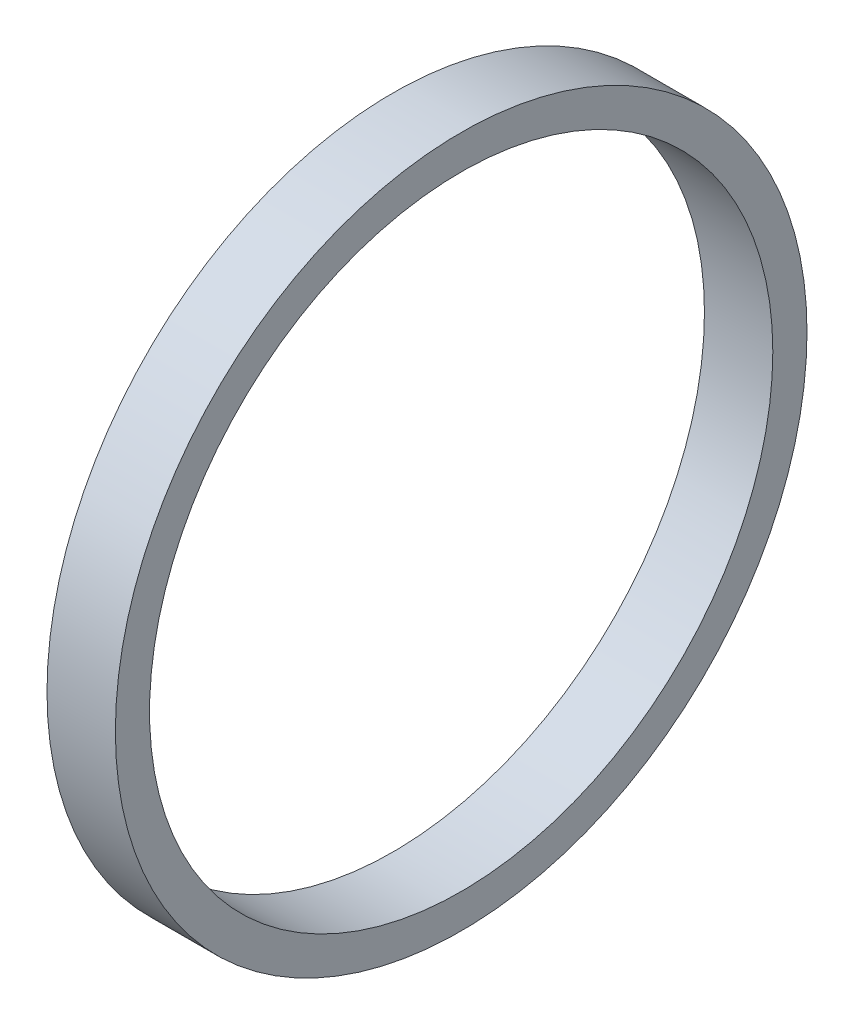
from build123d import *

# Parameters (mm, degrees)
SKETCH2_R           = 30.35
SKETCH2_R_2         = 27.35
BOSS_EXTRUDE1_DEPTH = 6


with BuildPart() as part:
    # Sketch2 → Boss-Extrude1 (new body)
    with BuildSketch(Plane(origin=(-607.283297965, -0.378059601, -0.400909904), x_dir=(0, 0.7275361131199374, -0.686069387238881), z_dir=(1, 0, 0))):
        with Locations(Location((0, 0.551051552, 0), (0, 0, 313.319766534))):
            Circle(SKETCH2_R)
        with Locations(Location((0, 0.551051552, 0), (0, 0, 313.319766534))):
            Circle(SKETCH2_R_2, mode=Mode.SUBTRACT)
    extrude(amount=-BOSS_EXTRUDE1_DEPTH)


solid = part.part
